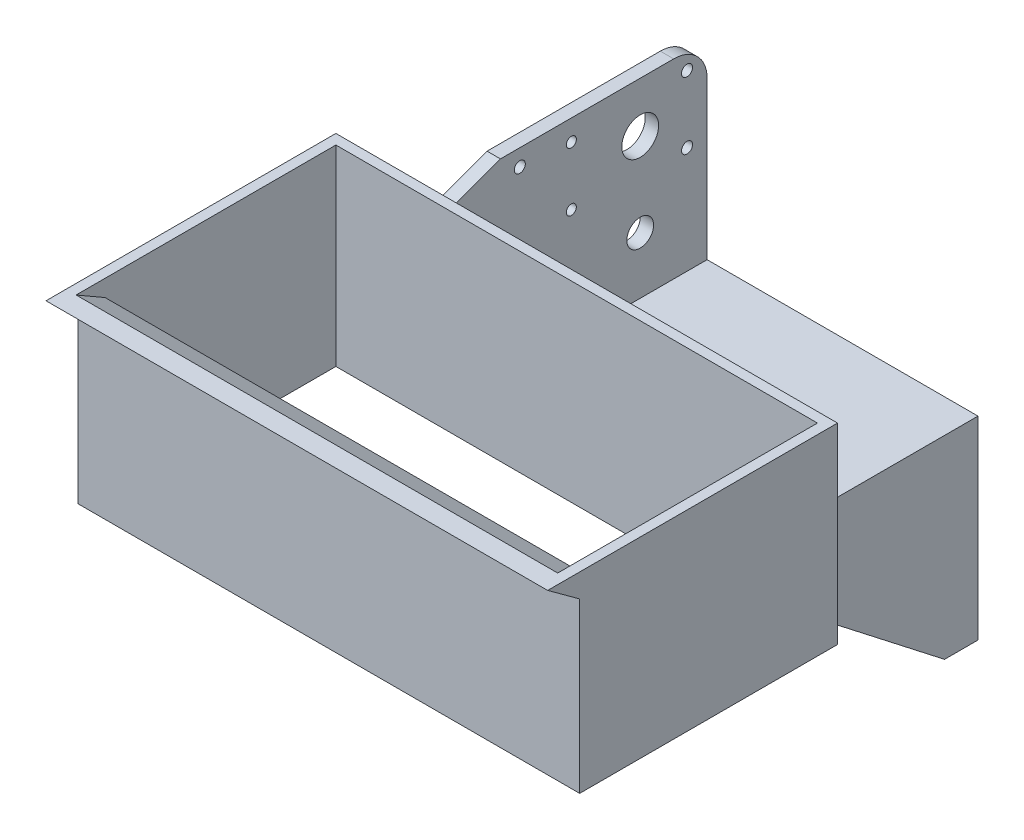
from build123d import *

# Parameters (mm, degrees)
SKETCH_1_W                   = 80
SKETCH_1_H                   = 50
EXTRUDE_1_DEPTH              = 5
HOLE_WIZARD_M5_1_D           = 4.2
HOLE_WIZARD_M5_1_DEPTH       = 11.1381927
HOLE_WIZARD_M5_1_TIP         = 1.2618073
EXTRUDE_START                = -12
SKETCH_5_W                   = 80
SKETCH_5_H                   = 50
EXTRUDE_2_DEPTH              = 2
HOLE_WIZARD_M4_1_AT_2_COUNT  = 2
HOLE_WIZARD_M4_1_AT_2_PITCH  = 20
HOLE_WIZARD_M4_1_AT_3_COUNT  = 2
HOLE_WIZARD_M4_1_AT_3_PITCH  = 50
HOLE_WIZARD_M4_1_AT_4_COUNT  = 2
HOLE_WIZARD_M4_1_AT_4_PITCH  = 53.851648071
SKETCH_11_R                  = 5.5
SKETCH_11_R_2                = 1.5
CUT_EXTRUDE_1_DEPTH          = 107.681769764
CUT_EXTRUDE_2_DEPTH          = 103.46950766
CUT_EXTRUDE_2_DEPTH_BACK     = 103.46950766
SKETCH_13_3_W                = 52
SKETCH_13_3_H                = 75
SKETCH_13_3_W_2              = 2
EXTRUDE_4_DEPTH              = 75
SKETCH_16_W                  = 80
SKETCH_16_H                  = 54
SKETCH_16_R                  = 2.1
EXTRUDE_5_DEPTH              = 10
SKETCH_17_W                  = 52
SKETCH_17_H                  = 51
CUT_EXTRUDE_4_DEPTH          = 65
SKETCH_18_W                  = 26
SKETCH_18_H                  = 5
SKETCH_18_W_2                = 2
EXTRUDE_6_DEPTH              = 75
SKETCH_19_R                  = 5.5
SKETCH_19_R_2                = 1.5
CUT_EXTRUDE_5_DEPTH          = 163.480768093
CUT_EXTRUDE_6_DEPTH          = 135.629120178
CUT_EXTRUDE_6_DEPTH_BACK     = 135.629120178
EXTRUDE_7_DEPTH              = 75
CUT_EXTRUDE_7_DEPTH          = 137.565002837
CUT_EXTRUDE_7_DEPTH_BACK     = 137.565002837
SKETCH_24_W                  = 102.975778391
SKETCH_24_H                  = 48.456033791
EXTRUDE_8_DEPTH              = 75
CUT_EXTRUDE_8_DEPTH          = 137.565002837
CUT_EXTRUDE_8_DEPTH_BACK     = 137.565002837
EXTRUDE_9_DEPTH              = 75
MIRROR_20_COPY_1_SKETCH_R    = 5.5
MIRROR_20_COPY_1_SKETCH_R_2  = 1.5
MIRROR_20_COPY_1_DEPTH       = 163.480768093
MIRROR_20_COPY_2_SKETCH_R    = 5.5
MIRROR_20_COPY_2_SKETCH_R_2  = 1.5
MIRROR_20_COPY_2_DEPTH       = 163.480768093
MIRROR_22_COPY_1_SKETCH_R    = 5.5
MIRROR_22_COPY_1_SKETCH_R_2  = 1.5
MIRROR_22_COPY_1_DEPTH       = 163.480768093
MIRROR_22_COPY_2_SKETCH_R    = 5.5
MIRROR_22_COPY_2_SKETCH_R_2  = 1.5
MIRROR_22_COPY_2_DEPTH       = 163.480768093
MIRROR_22_COPY_15_SKETCH_R   = 5.5
MIRROR_22_COPY_15_SKETCH_R_2 = 1.5
MIRROR_22_COPY_15_DEPTH      = 163.480768093
SKETCH_28_W                  = 112
SKETCH_28_H                  = 59.65855823
CUT_EXTRUDE_9_DEPTH          = 100
SKETCH_29_W                  = 150
SKETCH_29_H                  = 62.156680644
EXTRUDE_10_DEPTH             = 95
CUT_EXTRUDE_10_DEPTH         = 252.246890528
CUT_EXTRUDE_10_DEPTH_BACK    = 252.246890528
CUT_EXTRUDE_START            = -3
CUT_EXTRUDE_11_DEPTH         = 144
CUT_EXTRUDE_12_DEPTH         = 227.349287607
CUT_EXTRUDE_12_DEPTH_BACK    = 227.349287607
SKETCH_34_W                  = 45
SKETCH_34_H                  = 3
EXTRUDE_11_DEPTH             = 20
EXTRUDE_START_2              = -118
SKETCH_34_3_W                = 45
SKETCH_34_3_H                = 3
EXTRUDE_12_DEPTH             = 20
SKETCH_35_R                  = 2.1
SKETCH_35_W                  = 12
SKETCH_35_H                  = 54
CUT_EXTRUDE_13_DEPTH         = 10
SKETCH_37_W                  = 75
SKETCH_37_H                  = 62
SKETCH_37_R                  = 5.5
SKETCH_37_R_2                = 1.5
SKETCH_37_R_3                = 1.65
EXTRUDE_13_DEPTH             = 3
SKETCH_38_W                  = 45
SKETCH_38_H                  = 3
EXTRUDE_14_DEPTH             = 20
CUT_EXTRUDE_17_REACH         = 160.953
CUT_EXTRUDE_18_DEPTH         = 232.071417531
CUT_EXTRUDE_18_DEPTH_BACK    = 232.071417531
SKETCH_40_R                  = 4
SKETCH_48_W                  = 7.492398002
SKETCH_48_H                  = 29.711233458
SKETCH_48_W_2                = 8.655011485
EXTRUDE_18_DEPTH             = 10
CUT_EXTRUDE_20_DEPTH         = 212.00947846
CUT_EXTRUDE_20_DEPTH_BACK    = 212.00947846
CUT_EXTRUDE_22_DEPTH         = 2
EXTRUDE_20_DEPTH             = 14
CUT_EXTRUDE_23_DEPTH         = 207.458228221
CUT_EXTRUDE_23_DEPTH_BACK    = 207.458228221
SKETCH_52_R                  = 2.1
CUT_EXTRUDE_24_DEPTH         = 200.032660636
CUT_EXTRUDE_24_DEPTH_BACK    = 200.032660636
SKETCH_55_W                  = 12
SKETCH_55_H                  = 25
EXTRUDE_21_DEPTH             = 3
EXTRUDE_START_3              = 51
EXTRUDE_22_DEPTH             = 3
EXTRUDE_23_DEPTH             = 147
CUT_EXTRUDE_START_2          = -41
SKETCH_60_W                  = 48
SKETCH_60_H                  = 5
CUT_EXTRUDE_26_DEPTH         = 41
SKETCH_61_W                  = 144
SKETCH_61_H                  = 10.34377693
CUT_EXTRUDE_27_DEPTH         = 167
EXTRUDE_24_DEPTH             = 150
CUT_EXTRUDE_28_DEPTH         = 167
CUT_EXTRUDE_28_DEPTH_BACK    = 167
SKETCH_64_W                  = 144
SKETCH_64_H                  = 10
SKETCH_65_W                  = 150
SKETCH_65_H                  = 50.350916291
EXTRUDE_25_DEPTH             = 2.55
CUT_EXTRUDE_29_DEPTH         = 215.55
EXTRUDE_26_DEPTH             = 150
CUT_EXTRUDE_30_DEPTH         = 215.55
CUT_EXTRUDE_31_DEPTH         = 215.55
CUT_EXTRUDE_32_DEPTH         = 214.421451294
CUT_EXTRUDE_32_DEPTH_BACK    = 214.421451294
SKETCH_70_W                  = 144
SKETCH_70_H                  = 4.973795983
FILLET_1_R                   = 10
SKETCH_72_W                  = 16.700006523
SKETCH_72_H                  = 3
CUT_EXTRUDE_33_DEPTH         = 54.5
SKETCH_71_R                  = 4
SKETCH_71_R_2                = 1.65
SKETCH_71_R_3                = 5.5
SKETCH_71_R_4                = 1.5
EXTRUDE_27_DEPTH             = 8
SKETCH_73_W                  = 5
SKETCH_73_H                  = 5
EXTRUDE_28_DEPTH             = 75
CUT_EXTRUDE_34_REACH         = 201.66
SKETCH_74_W                  = 4
SKETCH_74_H                  = 57


with BuildPart() as part:
    # 草图1 → 凸台-拉伸1 (new body)
    with BuildSketch(Plane.XY):
        Rectangle(SKETCH_1_W, SKETCH_1_H)
    extrude(amount=EXTRUDE_1_DEPTH)

    # M5 螺纹孔1
    with Locations(Plane.XY.offset(5)):
        with Locations((-30, 20), (-30, -20), (30, -20), (30, 20)):
            Hole(HOLE_WIZARD_M5_1_D / 2, depth=HOLE_WIZARD_M5_1_DEPTH)
            with Locations((0, 0, -(HOLE_WIZARD_M5_1_DEPTH + HOLE_WIZARD_M5_1_TIP / 2))):  # 118° drill point
                Cone(0, HOLE_WIZARD_M5_1_D / 2, HOLE_WIZARD_M5_1_TIP, mode=Mode.SUBTRACT)

    # 草图5 → 凸台-拉伸2 (add)
    with BuildSketch(Plane(origin=(40, 0, 0), x_dir=(0, 0, -1), z_dir=(1, 0, 0)).offset(EXTRUDE_START)):
        with Locations((-40, 0)):
            Rectangle(SKETCH_5_W, SKETCH_5_H)
    extrude_2 = extrude(amount=-EXTRUDE_2_DEPTH)

    # 草图8 → M4 螺纹孔1 (revolve, cut)
    with BuildSketch(Plane(origin=(26, 20, 11), x_dir=(0, 0, 1), z_dir=(0, 1, 0))):
        Polygon((0, 0), (0, 10.1), (1.65, 9.108579979), (1.65, 0), align=None)
    hole_wizard_m4_1 = revolve(axis=Axis((19.65, 20, 11), (1, 0, 0)), mode=Mode.SUBTRACT)

    # M4 螺纹孔1 at 2: M4 螺纹孔1 ×2
    with Locations(*[(0, -i * HOLE_WIZARD_M4_1_AT_2_PITCH, 0) for i in range(1, HOLE_WIZARD_M4_1_AT_2_COUNT)]):
        add(hole_wizard_m4_1, mode=Mode.SUBTRACT)

    # M4 螺纹孔1 at 3: M4 螺纹孔1 ×2
    with Locations(*[(0, 0, i * HOLE_WIZARD_M4_1_AT_3_PITCH) for i in range(1, HOLE_WIZARD_M4_1_AT_3_COUNT)]):
        add(hole_wizard_m4_1, mode=Mode.SUBTRACT)

    # M4 螺纹孔1 at 4: M4 螺纹孔1 ×2
    with Locations(*[Vector(0, -0.3713906763541037, 0.9284766908852594) * (i * HOLE_WIZARD_M4_1_AT_4_PITCH) for i in range(1, HOLE_WIZARD_M4_1_AT_4_COUNT)]):
        add(hole_wizard_m4_1, mode=Mode.SUBTRACT)

    # 草图11 → 切除-拉伸1 (cut, through all)
    with BuildSketch(Plane.ZY.offset(-26)):
        with Locations((25, 10)):
            Circle(SKETCH_11_R)
        with Locations((45.6, 18.75)):
            Circle(SKETCH_11_R_2)
        with Locations((45.6, 1.25)):
            Circle(SKETCH_11_R_2)
    cut_extrude_1 = extrude(amount=-CUT_EXTRUDE_1_DEPTH, mode=Mode.SUBTRACT)

    # 镜向1: 凸台-拉伸2 across plane
    add(extrude_2.mirror(Plane(origin=(0, 0, 0), x_dir=(0, 0, 1), z_dir=(1, 0, 0))))

    # 镜向2: M4 螺纹孔1, 切除-拉伸1 across plane
    add(hole_wizard_m4_1.mirror(Plane(origin=(0, 0, 0), x_dir=(0, 0, 1), z_dir=(1, 0, 0))), mode=Mode.SUBTRACT)
    add(cut_extrude_1.mirror(Plane(origin=(0, 0, 0), x_dir=(0, 0, 1), z_dir=(1, 0, 0))), mode=Mode.SUBTRACT)

    # 镜向2 copy 1 sketch → 镜向2 copy 1 (revolve, cut)
    with BuildSketch(Plane(origin=(-26, 0, 11), x_dir=(0, 0, 1), z_dir=(0, 1, 0))):
        Polygon((0, 0), (0, -10.1), (1.65, -9.108579979), (1.65, 0), align=None)
    revolve(axis=Axis((-19.65, 0, 11), (1, 0, 0)), mode=Mode.SUBTRACT)

    # 镜向2 copy 2 sketch → 镜向2 copy 2 (revolve, cut)
    with BuildSketch(Plane(origin=(-26, 20, 61), x_dir=(0, 0, 1), z_dir=(0, 1, 0))):
        Polygon((0, 0), (0, -10.1), (1.65, -9.108579979), (1.65, 0), align=None)
    revolve(axis=Axis((-19.65, 20, 61), (1, 0, 0)), mode=Mode.SUBTRACT)

    # 镜向2 copy 3 sketch → 镜向2 copy 3 (revolve, cut)
    with BuildSketch(Plane(origin=(-26, 0, 61), x_dir=(0, 0, 1), z_dir=(0, 1, 0))):
        Polygon((0, 0), (0, -10.1), (1.65, -9.108579979), (1.65, 0), align=None)
    revolve(axis=Axis((-19.65, 0, 61), (1, 0, 0)), mode=Mode.SUBTRACT)

    # 草图13 → 切除-拉伸2 (cut, two sides: drawn at the far end of the back side and taken through both)
    with BuildSketch(Plane.XZ.offset(25).offset(-CUT_EXTRUDE_2_DEPTH_BACK)):
        Polygon((-26, 5), (-28, 5), (-40, 5), (-40, 0), (40, 0), (40, 5), (28, 5), (26, 5), align=None)
        Polygon((41.874754077, 5), (40, 5), (40, 0), (-40, 0), (-40, -4.933719331), (41.874754077, -4.933719331), align=None)
    extrude(amount=CUT_EXTRUDE_2_DEPTH + CUT_EXTRUDE_2_DEPTH_BACK, mode=Mode.SUBTRACT)


with BuildPart() as cut_extrude_2_piece_1:
    # of the separate pieces the step leaves, piece 1, a body of its own (cut_extrude_2_pieces)
    add(part.part.solids().sort_by_distance((28, -25, 5))[0])



with BuildPart() as cut_extrude_2_piece_2:
    # of the separate pieces the step leaves, piece 2, a body of its own (cut_extrude_2_pieces)
    add(part.part.solids().sort_by_distance((-26, -25, 5))[0])


with BuildPart() as cut_extrude_2_piece_1_1:
    add(cut_extrude_2_piece_1.part)

    add(cut_extrude_2_piece_2.part)  # 凸台-拉伸4 merges 切除-拉伸2 piece 2
    # 草图13<3> → 凸台-拉伸4 (add)
    with BuildSketch(Plane.XZ.offset(25)):
        with Locations((0, 42.5)):
            Rectangle(SKETCH_13_3_W, SKETCH_13_3_H)
        with Locations((-27, 42.5)):
            Rectangle(SKETCH_13_3_W_2, SKETCH_13_3_H)
        with Locations((27, 42.5)):
            Rectangle(SKETCH_13_3_W_2, SKETCH_13_3_H)
    extrude(amount=EXTRUDE_4_DEPTH)

    # 草图16 → 凸台-拉伸5 (add)
    with BuildSketch(Plane(origin=(0, 0, 5), x_dir=(-1, 0, 0), z_dir=(0, 0, -1))):
        with Locations((0, -73)):
            Rectangle(SKETCH_16_W, SKETCH_16_H)
        with Locations((-12, -83)):
            Circle(SKETCH_16_R, mode=Mode.SUBTRACT)
        with Locations((12, -83)):
            Circle(SKETCH_16_R, mode=Mode.SUBTRACT)
        with Locations((-12, -63)):
            Circle(SKETCH_16_R, mode=Mode.SUBTRACT)
        with Locations((12, -63)):
            Circle(SKETCH_16_R, mode=Mode.SUBTRACT)
    extrude(amount=-EXTRUDE_5_DEPTH)

    # 草图17 → 切除-拉伸4 (cut)
    with BuildSketch(Plane.XY.offset(80)):
        with Locations((0, -74.5)):
            Rectangle(SKETCH_17_W, SKETCH_17_H)
    extrude(amount=-CUT_EXTRUDE_4_DEPTH, mode=Mode.SUBTRACT)

    # 草图18 → 凸台-拉伸6 (add)
    with BuildSketch(Plane.XY.offset(80)):
        Polygon((-28, -25), (-28, -20), (-48, -20), (-48, 25), (-50, 25), (-50, -25), align=None)
        with Locations((-13, -22.5)):
            Rectangle(SKETCH_18_W, SKETCH_18_H)
        with Locations((-27, -22.5)):
            Rectangle(SKETCH_18_W_2, SKETCH_18_H)
        with Locations((13, -22.5)):
            Rectangle(SKETCH_18_W, SKETCH_18_H)
        with Locations((27, -22.5)):
            Rectangle(SKETCH_18_W_2, SKETCH_18_H)
        Polygon((48, -20), (28, -20), (28, -25), (50, -25), (50, 25), (48, 25), align=None)
    extrude(amount=-EXTRUDE_6_DEPTH)

    # 草图19 → 切除-拉伸5 (cut, symmetric)
    with BuildSketch(Plane.ZY.offset(50)):
        with Locations((25, 10)):
            Circle(SKETCH_19_R)
        with Locations((45.6, 18.75)):
            Circle(SKETCH_19_R_2)
        with Locations((45.6, 1.25)):
            Circle(SKETCH_19_R_2)
    cut_extrude_5 = extrude(amount=CUT_EXTRUDE_5_DEPTH, both=True, mode=Mode.SUBTRACT)

    # 镜向3: M4 螺纹孔1 across plane
    add(hole_wizard_m4_1.mirror(Plane.ZY.offset(11)), mode=Mode.SUBTRACT)

    # 镜向3 copy 1 sketch → 镜向3 copy 1 (revolve, cut)
    with BuildSketch(Plane(origin=(-48, 0, 11), x_dir=(0, 0, 1), z_dir=(0, 1, 0))):
        Polygon((0, 0), (0, -10.1), (1.65, -9.108579979), (1.65, 0), align=None)
    revolve(axis=Axis((-41.65, 0, 11), (1, 0, 0)), mode=Mode.SUBTRACT)

    # 镜向3 copy 2 sketch → 镜向3 copy 2 (revolve, cut)
    with BuildSketch(Plane(origin=(-48, 20, 61), x_dir=(0, 0, 1), z_dir=(0, 1, 0))):
        Polygon((0, 0), (0, -10.1), (1.65, -9.108579979), (1.65, 0), align=None)
    revolve(axis=Axis((-41.65, 20, 61), (1, 0, 0)), mode=Mode.SUBTRACT)

    # 镜向3 copy 3 sketch → 镜向3 copy 3 (revolve, cut)
    with BuildSketch(Plane(origin=(-48, 0, 61), x_dir=(0, 0, 1), z_dir=(0, 1, 0))):
        Polygon((0, 0), (0, -10.1), (1.65, -9.108579979), (1.65, 0), align=None)
    revolve(axis=Axis((-41.65, 0, 61), (1, 0, 0)), mode=Mode.SUBTRACT)

    # 镜向4: M4 螺纹孔1 across plane
    add(hole_wizard_m4_1.mirror(Plane(origin=(38, 0, 0), x_dir=(0, 0, 1), z_dir=(1, 0, 0))), mode=Mode.SUBTRACT)

    # 镜向4 copy 1 sketch → 镜向4 copy 1 (revolve, cut)
    with BuildSketch(Plane(origin=(50, 0, 11), x_dir=(0, 0, 1), z_dir=(0, 1, 0))):
        Polygon((0, 0), (0, -10.1), (1.65, -9.108579979), (1.65, 0), align=None)
    revolve(axis=Axis((56.35, 0, 11), (1, 0, 0)), mode=Mode.SUBTRACT)

    # 镜向4 copy 2 sketch → 镜向4 copy 2 (revolve, cut)
    with BuildSketch(Plane(origin=(50, 20, 61), x_dir=(0, 0, 1), z_dir=(0, 1, 0))):
        Polygon((0, 0), (0, -10.1), (1.65, -9.108579979), (1.65, 0), align=None)
    revolve(axis=Axis((56.35, 20, 61), (1, 0, 0)), mode=Mode.SUBTRACT)

    # 镜向4 copy 3 sketch → 镜向4 copy 3 (revolve, cut)
    with BuildSketch(Plane(origin=(50, 0, 61), x_dir=(0, 0, 1), z_dir=(0, 1, 0))):
        Polygon((0, 0), (0, -10.1), (1.65, -9.108579979), (1.65, 0), align=None)
    revolve(axis=Axis((56.35, 0, 61), (1, 0, 0)), mode=Mode.SUBTRACT)

    # 草图21 → 切除-拉伸6 (cut, two sides: drawn at the far end of the back side and taken through both)
    with BuildSketch(Plane.XY.offset(80).offset(-CUT_EXTRUDE_6_DEPTH_BACK)):
        Polygon((-31.758611736, 26.765489653), (-31.758611736, -20), (32.437571978, -20), (32.437571978, 28.405937278), align=None)
    extrude(amount=CUT_EXTRUDE_6_DEPTH + CUT_EXTRUDE_6_DEPTH_BACK, mode=Mode.SUBTRACT)

    # 草图22 → 凸台-拉伸7 (add)
    with BuildSketch(Plane.XY.offset(80)):
        Polygon((-53, 25), (-55, 25), (-55, -25), (-50, -25), (-50, -20), (-53, -20), align=None)
        Polygon((55, 25), (53, 25), (53, -20), (50, -20), (50, -25), (55, -25), align=None)
        Polygon((-50, -20), (-50, -25), (-28, -25), (28, -25), (50, -25), (50, -20), (48, -20), (0, -20), (-48, -20), align=None)
    extrude(amount=-EXTRUDE_7_DEPTH)

    # 镜向8: 切除-拉伸5 across plane
    add(cut_extrude_5.mirror(Plane(origin=(-51.5, 0, 0), x_dir=(0, 0, 1), z_dir=(1, 0, 0))), mode=Mode.SUBTRACT)

    # 镜向16 copy 1 sketch → 镜向16 copy 1 (revolve, cut)
    with BuildSketch(Plane(origin=(53, 20, 11), x_dir=(0, 0, 1), z_dir=(0, 1, 0))):
        Polygon((0, 0), (0, 10.1), (1.65, 9.108579979), (1.65, 0), align=None)
    revolve(axis=Axis((46.65, 20, 11), (1, 0, 0)), mode=Mode.SUBTRACT)

    # 镜向16 copy 2 sketch → 镜向16 copy 2 (revolve, cut)
    with BuildSketch(Plane(origin=(53, 0, 11), x_dir=(0, 0, 1), z_dir=(0, 1, 0))):
        Polygon((0, 0), (0, 10.1), (1.65, 9.108579979), (1.65, 0), align=None)
    revolve(axis=Axis((46.65, 0, 11), (1, 0, 0)), mode=Mode.SUBTRACT)

    # 镜向16 copy 3 sketch → 镜向16 copy 3 (revolve, cut)
    with BuildSketch(Plane(origin=(53, 20, 61), x_dir=(0, 0, 1), z_dir=(0, 1, 0))):
        Polygon((0, 0), (0, 10.1), (1.65, 9.108579979), (1.65, 0), align=None)
    revolve(axis=Axis((46.65, 20, 61), (1, 0, 0)), mode=Mode.SUBTRACT)

    # 镜向16 copy 4 sketch → 镜向16 copy 4 (revolve, cut)
    with BuildSketch(Plane(origin=(53, 0, 61), x_dir=(0, 0, 1), z_dir=(0, 1, 0))):
        Polygon((0, 0), (0, 10.1), (1.65, 9.108579979), (1.65, 0), align=None)
    revolve(axis=Axis((46.65, 0, 61), (1, 0, 0)), mode=Mode.SUBTRACT)

    # 镜向16 copy 5 sketch → 镜向16 copy 5 (revolve, cut)
    with BuildSketch(Plane(origin=(-21, 20, 11), x_dir=(0, 0, 1), z_dir=(0, 1, 0))):
        Polygon((0, 0), (0, -10.1), (1.65, -9.108579979), (1.65, 0), align=None)
    revolve(axis=Axis((-14.65, 20, 11), (1, 0, 0)), mode=Mode.SUBTRACT)

    # 镜向16 copy 6 sketch → 镜向16 copy 6 (revolve, cut)
    with BuildSketch(Plane(origin=(-21, 0, 11), x_dir=(0, 0, 1), z_dir=(0, 1, 0))):
        Polygon((0, 0), (0, -10.1), (1.65, -9.108579979), (1.65, 0), align=None)
    revolve(axis=Axis((-14.65, 0, 11), (1, 0, 0)), mode=Mode.SUBTRACT)

    # 镜向16 copy 7 sketch → 镜向16 copy 7 (revolve, cut)
    with BuildSketch(Plane(origin=(-21, 20, 61), x_dir=(0, 0, 1), z_dir=(0, 1, 0))):
        Polygon((0, 0), (0, -10.1), (1.65, -9.108579979), (1.65, 0), align=None)
    revolve(axis=Axis((-14.65, 20, 61), (1, 0, 0)), mode=Mode.SUBTRACT)

    # 镜向16 copy 8 sketch → 镜向16 copy 8 (revolve, cut)
    with BuildSketch(Plane(origin=(-21, 0, 61), x_dir=(0, 0, 1), z_dir=(0, 1, 0))):
        Polygon((0, 0), (0, -10.1), (1.65, -9.108579979), (1.65, 0), align=None)
    revolve(axis=Axis((-14.65, 0, 61), (1, 0, 0)), mode=Mode.SUBTRACT)

    # 镜向18 copy 1 sketch → 镜向18 copy 1 (revolve, cut)
    with BuildSketch(Plane(origin=(-53, 20, 11), x_dir=(0, 0, 1), z_dir=(0, 1, 0))):
        Polygon((0, 0), (0, -10.1), (1.65, -9.108579979), (1.65, 0), align=None)
    revolve(axis=Axis((-46.65, 20, 11), (1, 0, 0)), mode=Mode.SUBTRACT)

    # 镜向18 copy 2 sketch → 镜向18 copy 2 (revolve, cut)
    with BuildSketch(Plane(origin=(-53, 0, 11), x_dir=(0, 0, 1), z_dir=(0, 1, 0))):
        Polygon((0, 0), (0, -10.1), (1.65, -9.108579979), (1.65, 0), align=None)
    revolve(axis=Axis((-46.65, 0, 11), (1, 0, 0)), mode=Mode.SUBTRACT)

    # 镜向18 copy 3 sketch → 镜向18 copy 3 (revolve, cut)
    with BuildSketch(Plane(origin=(-53, 20, 61), x_dir=(0, 0, 1), z_dir=(0, 1, 0))):
        Polygon((0, 0), (0, -10.1), (1.65, -9.108579979), (1.65, 0), align=None)
    revolve(axis=Axis((-46.65, 20, 61), (1, 0, 0)), mode=Mode.SUBTRACT)

    # 镜向18 copy 4 sketch → 镜向18 copy 4 (revolve, cut)
    with BuildSketch(Plane(origin=(-53, 0, 61), x_dir=(0, 0, 1), z_dir=(0, 1, 0))):
        Polygon((0, 0), (0, -10.1), (1.65, -9.108579979), (1.65, 0), align=None)
    revolve(axis=Axis((-46.65, 0, 61), (1, 0, 0)), mode=Mode.SUBTRACT)

    # 镜向18 copy 5 sketch → 镜向18 copy 5 (revolve, cut)
    with BuildSketch(Plane(origin=(21, 20, 11), x_dir=(0, 0, 1), z_dir=(0, 1, 0))):
        Polygon((0, 0), (0, 10.1), (1.65, 9.108579979), (1.65, 0), align=None)
    revolve(axis=Axis((14.65, 20, 11), (1, 0, 0)), mode=Mode.SUBTRACT)

    # 镜向18 copy 6 sketch → 镜向18 copy 6 (revolve, cut)
    with BuildSketch(Plane(origin=(21, 0, 11), x_dir=(0, 0, 1), z_dir=(0, 1, 0))):
        Polygon((0, 0), (0, 10.1), (1.65, 9.108579979), (1.65, 0), align=None)
    revolve(axis=Axis((14.65, 0, 11), (1, 0, 0)), mode=Mode.SUBTRACT)

    # 镜向18 copy 7 sketch → 镜向18 copy 7 (revolve, cut)
    with BuildSketch(Plane(origin=(21, 20, 61), x_dir=(0, 0, 1), z_dir=(0, 1, 0))):
        Polygon((0, 0), (0, 10.1), (1.65, 9.108579979), (1.65, 0), align=None)
    revolve(axis=Axis((14.65, 20, 61), (1, 0, 0)), mode=Mode.SUBTRACT)

    # 镜向18 copy 8 sketch → 镜向18 copy 8 (revolve, cut)
    with BuildSketch(Plane(origin=(21, 0, 61), x_dir=(0, 0, 1), z_dir=(0, 1, 0))):
        Polygon((0, 0), (0, 10.1), (1.65, 9.108579979), (1.65, 0), align=None)
    revolve(axis=Axis((14.65, 0, 61), (1, 0, 0)), mode=Mode.SUBTRACT)

    # 镜向18 copy 9 sketch → 镜向18 copy 9 (revolve, cut)
    with BuildSketch(Plane(origin=(-26, 20, 11), x_dir=(0, 0, 1), z_dir=(0, 1, 0))):
        Polygon((0, 0), (0, -10.1), (1.65, -9.108579979), (1.65, 0), align=None)
    revolve(axis=Axis((-19.65, 20, 11), (1, 0, 0)), mode=Mode.SUBTRACT)

    # 镜向18 copy 10 sketch → 镜向18 copy 10 (revolve, cut)
    with BuildSketch(Plane(origin=(-26, 0, 11), x_dir=(0, 0, 1), z_dir=(0, 1, 0))):
        Polygon((0, 0), (0, -10.1), (1.65, -9.108579979), (1.65, 0), align=None)
    revolve(axis=Axis((-19.65, 0, 11), (1, 0, 0)), mode=Mode.SUBTRACT)

    # 镜向18 copy 11 sketch → 镜向18 copy 11 (revolve, cut)
    with BuildSketch(Plane(origin=(-26, 20, 61), x_dir=(0, 0, 1), z_dir=(0, 1, 0))):
        Polygon((0, 0), (0, -10.1), (1.65, -9.108579979), (1.65, 0), align=None)
    revolve(axis=Axis((-19.65, 20, 61), (1, 0, 0)), mode=Mode.SUBTRACT)

    # 镜向18 copy 12 sketch → 镜向18 copy 12 (revolve, cut)
    with BuildSketch(Plane(origin=(-26, 0, 61), x_dir=(0, 0, 1), z_dir=(0, 1, 0))):
        Polygon((0, 0), (0, -10.1), (1.65, -9.108579979), (1.65, 0), align=None)
    revolve(axis=Axis((-19.65, 0, 61), (1, 0, 0)), mode=Mode.SUBTRACT)

    # 草图24 → 切除-拉伸7 (cut, two sides: drawn at the far end of the back side and taken through both)
    with BuildSketch(Plane(origin=(0, 0, 5), x_dir=(-1, 0, 0), z_dir=(0, 0, -1)).offset(-CUT_EXTRUDE_7_DEPTH_BACK)):
        with Locations((0.012110804, 4.228016896)):
            Rectangle(SKETCH_24_W, SKETCH_24_H)
    extrude(amount=CUT_EXTRUDE_7_DEPTH + CUT_EXTRUDE_7_DEPTH_BACK, mode=Mode.SUBTRACT)

    # 草图25 → 凸台-拉伸8 (add)
    with BuildSketch(Plane(origin=(0, 0, 5), x_dir=(-1, 0, 0), z_dir=(0, 0, -1))):
        Polygon((-53, -25), (-53, -32), (53, -32), (53, -25), (55, -25), (55, -37), (-55, -37), (-55, -25), align=None)
    extrude(amount=-EXTRUDE_8_DEPTH)

    # 草图26 → 切除-拉伸8 (cut, two sides: drawn at the far end of the back side and taken through both)
    with BuildSketch(Plane(origin=(0, 0, 5), x_dir=(-1, 0, 0), z_dir=(0, 0, -1)).offset(-CUT_EXTRUDE_8_DEPTH_BACK)):
        Polygon((-53, -20), (-53, -32), (53, -32), (53, -15.706954255), (-53, -15.706954255), align=None)
    extrude(amount=CUT_EXTRUDE_8_DEPTH + CUT_EXTRUDE_8_DEPTH_BACK, mode=Mode.SUBTRACT)

    # 草图27 → 凸台-拉伸9 (add)
    with BuildSketch(Plane(origin=(0, 0, 5), x_dir=(-1, 0, 0), z_dir=(0, 0, -1))):
        Polygon((-59, 25), (-59, -37), (59, -37), (59, 25), (57, 25), (57, -32), (-57, -32), (-57, 25), align=None)
    extrude(amount=-EXTRUDE_9_DEPTH)

    # 镜向20 copy 1 sketch → 镜向20 copy 1 (cut, symmetric)
    with BuildSketch(Plane.ZY.offset(-165)):
        with Locations((25, 10)):
            Circle(MIRROR_20_COPY_1_SKETCH_R)
        with Locations((45.6, 18.75)):
            Circle(MIRROR_20_COPY_1_SKETCH_R_2)
        with Locations((45.6, 1.25)):
            Circle(MIRROR_20_COPY_1_SKETCH_R_2)
    extrude(amount=MIRROR_20_COPY_1_DEPTH, both=True, mode=Mode.SUBTRACT)

    # 镜向20 copy 2 sketch → 镜向20 copy 2 (cut, symmetric)
    with BuildSketch(Plane(origin=(162, 0, 0), x_dir=(0, 0, 1), z_dir=(1, 0, 0))):
        with Locations((25, -10)):
            Circle(MIRROR_20_COPY_2_SKETCH_R)
        with Locations((45.6, -18.75)):
            Circle(MIRROR_20_COPY_2_SKETCH_R_2)
        with Locations((45.6, -1.25)):
            Circle(MIRROR_20_COPY_2_SKETCH_R_2)
    extrude(amount=MIRROR_20_COPY_2_DEPTH, both=True, mode=Mode.SUBTRACT)

    # 镜向20 copy 3 sketch → 镜向20 copy 3 (revolve, cut)
    with BuildSketch(Plane(origin=(59, 20, 11), x_dir=(0, 0, 1), z_dir=(0, 1, 0))):
        Polygon((0, 0), (0, -10.1), (1.65, -9.108579979), (1.65, 0), align=None)
    revolve(axis=Axis((65.35, 20, 11), (1, 0, 0)), mode=Mode.SUBTRACT)

    # 镜向20 copy 4 sketch → 镜向20 copy 4 (revolve, cut)
    with BuildSketch(Plane(origin=(59, 0, 11), x_dir=(0, 0, 1), z_dir=(0, 1, 0))):
        Polygon((0, 0), (0, -10.1), (1.65, -9.108579979), (1.65, 0), align=None)
    revolve(axis=Axis((65.35, 0, 11), (1, 0, 0)), mode=Mode.SUBTRACT)

    # 镜向20 copy 5 sketch → 镜向20 copy 5 (revolve, cut)
    with BuildSketch(Plane(origin=(59, 20, 61), x_dir=(0, 0, 1), z_dir=(0, 1, 0))):
        Polygon((0, 0), (0, -10.1), (1.65, -9.108579979), (1.65, 0), align=None)
    revolve(axis=Axis((65.35, 20, 61), (1, 0, 0)), mode=Mode.SUBTRACT)

    # 镜向20 copy 6 sketch → 镜向20 copy 6 (revolve, cut)
    with BuildSketch(Plane(origin=(59, 0, 61), x_dir=(0, 0, 1), z_dir=(0, 1, 0))):
        Polygon((0, 0), (0, -10.1), (1.65, -9.108579979), (1.65, 0), align=None)
    revolve(axis=Axis((65.35, 0, 61), (1, 0, 0)), mode=Mode.SUBTRACT)

    # 镜向20 copy 7 sketch → 镜向20 copy 7 (revolve, cut)
    with BuildSketch(Plane(origin=(133, 20, 11), x_dir=(0, 0, 1), z_dir=(0, 1, 0))):
        Polygon((0, 0), (0, 10.1), (1.65, 9.108579979), (1.65, 0), align=None)
    revolve(axis=Axis((126.65, 20, 11), (1, 0, 0)), mode=Mode.SUBTRACT)

    # 镜向20 copy 8 sketch → 镜向20 copy 8 (revolve, cut)
    with BuildSketch(Plane(origin=(133, 0, 11), x_dir=(0, 0, 1), z_dir=(0, 1, 0))):
        Polygon((0, 0), (0, 10.1), (1.65, 9.108579979), (1.65, 0), align=None)
    revolve(axis=Axis((126.65, 0, 11), (1, 0, 0)), mode=Mode.SUBTRACT)

    # 镜向20 copy 9 sketch → 镜向20 copy 9 (revolve, cut)
    with BuildSketch(Plane(origin=(133, 20, 61), x_dir=(0, 0, 1), z_dir=(0, 1, 0))):
        Polygon((0, 0), (0, 10.1), (1.65, 9.108579979), (1.65, 0), align=None)
    revolve(axis=Axis((126.65, 20, 61), (1, 0, 0)), mode=Mode.SUBTRACT)

    # 镜向20 copy 10 sketch → 镜向20 copy 10 (revolve, cut)
    with BuildSketch(Plane(origin=(133, 0, 61), x_dir=(0, 0, 1), z_dir=(0, 1, 0))):
        Polygon((0, 0), (0, 10.1), (1.65, 9.108579979), (1.65, 0), align=None)
    revolve(axis=Axis((126.65, 0, 61), (1, 0, 0)), mode=Mode.SUBTRACT)

    # 镜向20 copy 11 sketch → 镜向20 copy 11 (revolve, cut)
    with BuildSketch(Plane(origin=(86, 20, 11), x_dir=(0, 0, 1), z_dir=(0, 1, 0))):
        Polygon((0, 0), (0, -10.1), (1.65, -9.108579979), (1.65, 0), align=None)
    revolve(axis=Axis((92.35, 20, 11), (1, 0, 0)), mode=Mode.SUBTRACT)

    # 镜向20 copy 12 sketch → 镜向20 copy 12 (revolve, cut)
    with BuildSketch(Plane(origin=(86, 0, 11), x_dir=(0, 0, 1), z_dir=(0, 1, 0))):
        Polygon((0, 0), (0, -10.1), (1.65, -9.108579979), (1.65, 0), align=None)
    revolve(axis=Axis((92.35, 0, 11), (1, 0, 0)), mode=Mode.SUBTRACT)

    # 镜向20 copy 13 sketch → 镜向20 copy 13 (revolve, cut)
    with BuildSketch(Plane(origin=(86, 20, 61), x_dir=(0, 0, 1), z_dir=(0, 1, 0))):
        Polygon((0, 0), (0, -10.1), (1.65, -9.108579979), (1.65, 0), align=None)
    revolve(axis=Axis((92.35, 20, 61), (1, 0, 0)), mode=Mode.SUBTRACT)

    # 镜向20 copy 14 sketch → 镜向20 copy 14 (revolve, cut)
    with BuildSketch(Plane(origin=(86, 0, 61), x_dir=(0, 0, 1), z_dir=(0, 1, 0))):
        Polygon((0, 0), (0, -10.1), (1.65, -9.108579979), (1.65, 0), align=None)
    revolve(axis=Axis((92.35, 0, 61), (1, 0, 0)), mode=Mode.SUBTRACT)

    # 镜向22 copy 1 sketch → 镜向22 copy 1 (cut, symmetric)
    with BuildSketch(Plane(origin=(-165, 0, 0), x_dir=(0, 0, 1), z_dir=(1, 0, 0))):
        with Locations((25, -10)):
            Circle(MIRROR_22_COPY_1_SKETCH_R)
        with Locations((45.6, -18.75)):
            Circle(MIRROR_22_COPY_1_SKETCH_R_2)
        with Locations((45.6, -1.25)):
            Circle(MIRROR_22_COPY_1_SKETCH_R_2)
    extrude(amount=MIRROR_22_COPY_1_DEPTH, both=True, mode=Mode.SUBTRACT)

    # 镜向22 copy 2 sketch → 镜向22 copy 2 (cut, symmetric)
    with BuildSketch(Plane.ZY.offset(162)):
        with Locations((25, 10)):
            Circle(MIRROR_22_COPY_2_SKETCH_R)
        with Locations((45.6, 18.75)):
            Circle(MIRROR_22_COPY_2_SKETCH_R_2)
        with Locations((45.6, 1.25)):
            Circle(MIRROR_22_COPY_2_SKETCH_R_2)
    extrude(amount=MIRROR_22_COPY_2_DEPTH, both=True, mode=Mode.SUBTRACT)

    # 镜向22 copy 3 sketch → 镜向22 copy 3 (revolve, cut)
    with BuildSketch(Plane(origin=(-59, 20, 11), x_dir=(0, 0, 1), z_dir=(0, 1, 0))):
        Polygon((0, 0), (0, 10.1), (1.65, 9.108579979), (1.65, 0), align=None)
    revolve(axis=Axis((-65.35, 20, 11), (1, 0, 0)), mode=Mode.SUBTRACT)

    # 镜向22 copy 4 sketch → 镜向22 copy 4 (revolve, cut)
    with BuildSketch(Plane(origin=(-59, 0, 11), x_dir=(0, 0, 1), z_dir=(0, 1, 0))):
        Polygon((0, 0), (0, 10.1), (1.65, 9.108579979), (1.65, 0), align=None)
    revolve(axis=Axis((-65.35, 0, 11), (1, 0, 0)), mode=Mode.SUBTRACT)

    # 镜向22 copy 5 sketch → 镜向22 copy 5 (revolve, cut)
    with BuildSketch(Plane(origin=(-59, 20, 61), x_dir=(0, 0, 1), z_dir=(0, 1, 0))):
        Polygon((0, 0), (0, 10.1), (1.65, 9.108579979), (1.65, 0), align=None)
    revolve(axis=Axis((-65.35, 20, 61), (1, 0, 0)), mode=Mode.SUBTRACT)

    # 镜向22 copy 6 sketch → 镜向22 copy 6 (revolve, cut)
    with BuildSketch(Plane(origin=(-59, 0, 61), x_dir=(0, 0, 1), z_dir=(0, 1, 0))):
        Polygon((0, 0), (0, 10.1), (1.65, 9.108579979), (1.65, 0), align=None)
    revolve(axis=Axis((-65.35, 0, 61), (1, 0, 0)), mode=Mode.SUBTRACT)

    # 镜向22 copy 7 sketch → 镜向22 copy 7 (revolve, cut)
    with BuildSketch(Plane(origin=(-133, 20, 11), x_dir=(0, 0, 1), z_dir=(0, 1, 0))):
        Polygon((0, 0), (0, -10.1), (1.65, -9.108579979), (1.65, 0), align=None)
    revolve(axis=Axis((-126.65, 20, 11), (1, 0, 0)), mode=Mode.SUBTRACT)

    # 镜向22 copy 8 sketch → 镜向22 copy 8 (revolve, cut)
    with BuildSketch(Plane(origin=(-133, 0, 11), x_dir=(0, 0, 1), z_dir=(0, 1, 0))):
        Polygon((0, 0), (0, -10.1), (1.65, -9.108579979), (1.65, 0), align=None)
    revolve(axis=Axis((-126.65, 0, 11), (1, 0, 0)), mode=Mode.SUBTRACT)

    # 镜向22 copy 9 sketch → 镜向22 copy 9 (revolve, cut)
    with BuildSketch(Plane(origin=(-133, 20, 61), x_dir=(0, 0, 1), z_dir=(0, 1, 0))):
        Polygon((0, 0), (0, -10.1), (1.65, -9.108579979), (1.65, 0), align=None)
    revolve(axis=Axis((-126.65, 20, 61), (1, 0, 0)), mode=Mode.SUBTRACT)

    # 镜向22 copy 10 sketch → 镜向22 copy 10 (revolve, cut)
    with BuildSketch(Plane(origin=(-133, 0, 61), x_dir=(0, 0, 1), z_dir=(0, 1, 0))):
        Polygon((0, 0), (0, -10.1), (1.65, -9.108579979), (1.65, 0), align=None)
    revolve(axis=Axis((-126.65, 0, 61), (1, 0, 0)), mode=Mode.SUBTRACT)

    # 镜向22 copy 11 sketch → 镜向22 copy 11 (revolve, cut)
    with BuildSketch(Plane(origin=(-86, 20, 11), x_dir=(0, 0, 1), z_dir=(0, 1, 0))):
        Polygon((0, 0), (0, 10.1), (1.65, 9.108579979), (1.65, 0), align=None)
    revolve(axis=Axis((-92.35, 20, 11), (1, 0, 0)), mode=Mode.SUBTRACT)

    # 镜向22 copy 12 sketch → 镜向22 copy 12 (revolve, cut)
    with BuildSketch(Plane(origin=(-86, 0, 11), x_dir=(0, 0, 1), z_dir=(0, 1, 0))):
        Polygon((0, 0), (0, 10.1), (1.65, 9.108579979), (1.65, 0), align=None)
    revolve(axis=Axis((-92.35, 0, 11), (1, 0, 0)), mode=Mode.SUBTRACT)

    # 镜向22 copy 13 sketch → 镜向22 copy 13 (revolve, cut)
    with BuildSketch(Plane(origin=(-86, 20, 61), x_dir=(0, 0, 1), z_dir=(0, 1, 0))):
        Polygon((0, 0), (0, 10.1), (1.65, 9.108579979), (1.65, 0), align=None)
    revolve(axis=Axis((-92.35, 20, 61), (1, 0, 0)), mode=Mode.SUBTRACT)

    # 镜向22 copy 14 sketch → 镜向22 copy 14 (revolve, cut)
    with BuildSketch(Plane(origin=(-86, 0, 61), x_dir=(0, 0, 1), z_dir=(0, 1, 0))):
        Polygon((0, 0), (0, 10.1), (1.65, 9.108579979), (1.65, 0), align=None)
    revolve(axis=Axis((-92.35, 0, 61), (1, 0, 0)), mode=Mode.SUBTRACT)

    # 镜向22 copy 15 sketch → 镜向22 copy 15 (cut, symmetric)
    with BuildSketch(Plane(origin=(50, 0, 0), x_dir=(0, 0, 1), z_dir=(1, 0, 0))):
        with Locations((25, -10)):
            Circle(MIRROR_22_COPY_15_SKETCH_R)
        with Locations((45.6, -18.75)):
            Circle(MIRROR_22_COPY_15_SKETCH_R_2)
        with Locations((45.6, -1.25)):
            Circle(MIRROR_22_COPY_15_SKETCH_R_2)
    extrude(amount=MIRROR_22_COPY_15_DEPTH, both=True, mode=Mode.SUBTRACT)

    # 镜向22 copy 16 sketch → 镜向22 copy 16 (revolve, cut)
    with BuildSketch(Plane(origin=(-26, 20, 11), x_dir=(0, 0, 1), z_dir=(0, 1, 0))):
        Polygon((0, 0), (0, -10.1), (1.65, -9.108579979), (1.65, 0), align=None)
    revolve(axis=Axis((-19.65, 20, 11), (1, 0, 0)), mode=Mode.SUBTRACT)

    # 镜向22 copy 17 sketch → 镜向22 copy 17 (revolve, cut)
    with BuildSketch(Plane(origin=(-26, 0, 11), x_dir=(0, 0, 1), z_dir=(0, 1, 0))):
        Polygon((0, 0), (0, -10.1), (1.65, -9.108579979), (1.65, 0), align=None)
    revolve(axis=Axis((-19.65, 0, 11), (1, 0, 0)), mode=Mode.SUBTRACT)

    # 镜向22 copy 18 sketch → 镜向22 copy 18 (revolve, cut)
    with BuildSketch(Plane(origin=(-26, 20, 61), x_dir=(0, 0, 1), z_dir=(0, 1, 0))):
        Polygon((0, 0), (0, -10.1), (1.65, -9.108579979), (1.65, 0), align=None)
    revolve(axis=Axis((-19.65, 20, 61), (1, 0, 0)), mode=Mode.SUBTRACT)

    # 镜向22 copy 19 sketch → 镜向22 copy 19 (revolve, cut)
    with BuildSketch(Plane(origin=(-26, 0, 61), x_dir=(0, 0, 1), z_dir=(0, 1, 0))):
        Polygon((0, 0), (0, -10.1), (1.65, -9.108579979), (1.65, 0), align=None)
    revolve(axis=Axis((-19.65, 0, 61), (1, 0, 0)), mode=Mode.SUBTRACT)

    # 草图28 → 切除-拉伸9 (cut)
    with BuildSketch(Plane(origin=(0, 0, 5), x_dir=(-1, 0, 0), z_dir=(0, 0, -1))):
        with Locations((0, -2.170720885)):
            Rectangle(SKETCH_28_W, SKETCH_28_H)
    extrude(amount=-CUT_EXTRUDE_9_DEPTH, mode=Mode.SUBTRACT)

    # 草图29 → 凸台-拉伸10 (add)
    with BuildSketch(Plane.XY.offset(80)):
        with Locations((0, -6.078340322)):
            Rectangle(SKETCH_29_W, SKETCH_29_H)
    extrude(amount=EXTRUDE_10_DEPTH)

    # 草图30 → 切除-拉伸10 (cut, two sides: drawn at the far end of the back side and taken through both)
    with BuildSketch(Plane.ZY.offset(75).offset(-CUT_EXTRUDE_10_DEPTH_BACK)):
        Polygon((549.139391609, 241.00947846), (175, 25), (145, 7.679491924), (145, -37.156680644), (145, -469.175637564), (895.959346342, -896.518095898), (1300.098737952, -186.332979874), align=None)
    extrude(amount=CUT_EXTRUDE_10_DEPTH + CUT_EXTRUDE_10_DEPTH_BACK, mode=Mode.SUBTRACT)

    # 草图31 → 切除-拉伸11 (cut)
    with BuildSketch(Plane.ZY.offset(75).offset(CUT_EXTRUDE_START)):
        Polygon((83, 29.827532825), (177.361532128, 29.827532825), (142, 9.411542732), (142, -50.308719278), (83, -50.308719278), align=None)
    extrude(amount=-CUT_EXTRUDE_11_DEPTH, mode=Mode.SUBTRACT)

    # 草图32 → 切除-拉伸12 (cut, two sides: drawn at the far end of the back side and taken through both)
    with BuildSketch(Plane(origin=(28, 0, 0), x_dir=(0, 0, -1), z_dir=(1, 0, 0)).offset(-CUT_EXTRUDE_12_DEPTH_BACK)):
        Polygon((-80, -37.156680644), (-15, -100), (-94.548678903, -113.254821135), align=None)
    extrude(amount=CUT_EXTRUDE_12_DEPTH + CUT_EXTRUDE_12_DEPTH_BACK, mode=Mode.SUBTRACT)

    # 草图34 → 凸台-拉伸11 (add)
    with BuildSketch(Plane(origin=(59, 0, 0), x_dir=(0, 0, -1), z_dir=(1, 0, 0))):
        with Locations((-36.5, -2.55)):
            Rectangle(SKETCH_34_W, SKETCH_34_H)
    extrude(amount=EXTRUDE_11_DEPTH)

    # 草图34<3> → 凸台-拉伸12 (add)
    with BuildSketch(Plane(origin=(59, 0, 0), x_dir=(0, 0, -1), z_dir=(1, 0, 0)).offset(EXTRUDE_START_2)):
        with Locations((-36.5, -2.55)):
            Rectangle(SKETCH_34_3_W, SKETCH_34_3_H)
    extrude(amount=-EXTRUDE_12_DEPTH)

    # 草图35 → 切除-拉伸13 (cut)
    with BuildSketch(Plane(origin=(0, 0, 5), x_dir=(-1, 0, 0), z_dir=(0, 0, -1))):
        with Locations((-12, -63)):
            Circle(SKETCH_35_R)
        with Locations((-12, -83)):
            Circle(SKETCH_35_R)
        with Locations((12, -63)):
            Circle(SKETCH_35_R)
        with Locations((12, -83)):
            Circle(SKETCH_35_R)
        with Locations((-34, -73)):
            Rectangle(SKETCH_35_W, SKETCH_35_H)
        with Locations((34, -73)):
            Rectangle(SKETCH_35_W, SKETCH_35_H)
    extrude(amount=-CUT_EXTRUDE_13_DEPTH, mode=Mode.SUBTRACT)

    # 草图37 → 凸台-拉伸13 (add)
    with BuildSketch(Plane(origin=(-35, 0, 0), x_dir=(0, 0, -1), z_dir=(1, 0, 0))):
        with Locations((-42.5, -6)):
            Rectangle(SKETCH_37_W, SKETCH_37_H)
        with Locations(Location((-25, 10, 0), (0, 0, 180))):
            Circle(SKETCH_37_R, mode=Mode.SUBTRACT)
        with Locations(Location((-45.6, 18.75, 0), (0, 0, 180))):
            Circle(SKETCH_37_R_2, mode=Mode.SUBTRACT)
        with Locations(Location((-45.6, 1.25, 0), (0, 0, 180))):
            Circle(SKETCH_37_R_2, mode=Mode.SUBTRACT)
        with Locations((-11, 0)):
            Circle(SKETCH_37_R_3, mode=Mode.SUBTRACT)
        with Locations((-11, 20)):
            Circle(SKETCH_37_R_3, mode=Mode.SUBTRACT)
        with Locations((-61, 20)):
            Circle(SKETCH_37_R_3, mode=Mode.SUBTRACT)
    extrude(amount=-EXTRUDE_13_DEPTH)

    # 草图38 → 凸台-拉伸14 (add)
    with BuildSketch(Plane.ZY.offset(38)):
        with Locations((36.5, -2.55)):
            Rectangle(SKETCH_38_W, SKETCH_38_H)
    extrude(amount=EXTRUDE_14_DEPTH)

    # 草图39 → 切除-拉伸17 (cut, up to next)
    with BuildSketch(Plane(origin=(0, 0, 80), x_dir=(-1, 0, 0), z_dir=(0, 0, -1)), mode=Mode.PRIVATE) as cut_extrude_17_sk1:
        Polygon((95.868527175, 12.016610291), (66.181267263, 27.926357316), (54.700006523, 26.778231242), (54.700006523, -26.855658213), (38, -26.855658213), (38, -47.849963565), (95.868527175, -47.849963565), align=None)
    cut_extrude_17_tool1 = extrude(cut_extrude_17_sk1.sketch, amount=CUT_EXTRUDE_17_REACH, mode=Mode.PRIVATE) & cut_extrude_2_piece_1_1.part
    # 草图39 → 切除-拉伸17 (cut, up to next)
    with BuildSketch(Plane(origin=(0, 0, 80), x_dir=(-1, 0, 0), z_dir=(0, 0, -1)), mode=Mode.PRIVATE) as cut_extrude_17_sk2:
        Polygon((-96.91110434, 26.778231242), (-96.91110434, -48.998089639), (-42, -48.998089639), (-42, 26.778231242), (-75.260726946, 26.778231242), align=None)
    cut_extrude_17_tool2 = extrude(cut_extrude_17_sk2.sketch, amount=CUT_EXTRUDE_17_REACH, mode=Mode.PRIVATE) & cut_extrude_2_piece_1_1.part
    add(cut_extrude_17_tool1.solids().sort_by_distance((-71.393203, -15.39823, 80))[0], mode=Mode.SUBTRACT)
    add(cut_extrude_17_tool2.solids().sort_by_distance((69.455552, -11.109929, 80))[0], mode=Mode.SUBTRACT)

    # 草图40 → 切除-拉伸18 (cut, two sides: drawn at the far end of the back side and taken through both)
    with BuildSketch(Plane.ZY.offset(38).offset(-CUT_EXTRUDE_18_DEPTH_BACK)):
        with Locations(Location((25, -15, 0), (0, 0, 180))):
            Circle(SKETCH_40_R)
        with Locations(Location((60, -15, 0), (0, 0, 180))):
            Circle(SKETCH_40_R)
    extrude(amount=CUT_EXTRUDE_18_DEPTH + CUT_EXTRUDE_18_DEPTH_BACK, mode=Mode.SUBTRACT)

    # 草图48 → 凸台-拉伸18 (add)
    with BuildSketch(Plane(origin=(0, 0, 5), x_dir=(-1, 0, 0), z_dir=(0, 0, -1))):
        with Locations((-12.207441573, -71.797097753)):
            Rectangle(SKETCH_48_W, SKETCH_48_H)
        with Locations((12.91792759, -71.797097753)):
            Rectangle(SKETCH_48_W_2, SKETCH_48_H)
    extrude(amount=-EXTRUDE_18_DEPTH)

    # 草图49 → 切除-拉伸20 (cut, two sides: drawn at the far end of the back side and taken through both)
    with BuildSketch(Plane(origin=(0, 0, 5), x_dir=(-1, 0, 0), z_dir=(0, 0, -1)).offset(-CUT_EXTRUDE_20_DEPTH_BACK)):
        Polygon((-28, -90), (12, -90), (12, -37.156680644), (28, -37), (28, -104.608633832), (-42.564571411, -106.287964419), (-39.851806617, -88.332045068), align=None)
    extrude(amount=CUT_EXTRUDE_20_DEPTH + CUT_EXTRUDE_20_DEPTH_BACK, mode=Mode.SUBTRACT)

    # 草图50 → 切除-拉伸22 (cut)
    with BuildSketch(Plane.ZY.offset(-26)):
        Polygon((15, -49), (15, -90), (25.343183757, -90), (67.750237161, -49), align=None)
    extrude(amount=-CUT_EXTRUDE_22_DEPTH, mode=Mode.SUBTRACT)

    # 草图53 → 凸台-拉伸20 (add)
    with BuildSketch(Plane(origin=(28, 0, 0), x_dir=(0, 0, -1), z_dir=(1, 0, 0))):
        Polygon((-67.750237161, -49), (-15, -49), (-15, -90), (-4.999994, -90), (-5, -37), (-80, -37), (-80, -37.156680644), align=None)
    extrude(amount=EXTRUDE_20_DEPTH)

    # 草图52 → 切除-拉伸23 (cut, two sides: drawn at the far end of the back side and taken through both)
    with BuildSketch(Plane(origin=(0, 0, 5), x_dir=(-1, 0, 0), z_dir=(0, 0, -1)).offset(-CUT_EXTRUDE_23_DEPTH_BACK)):
        with Locations((-8, -63)):
            Circle(SKETCH_52_R)
        with Locations((-8, -83)):
            Circle(SKETCH_52_R)
        with Locations(Location((-32, -83, 0), (0, 0, 270))):
            Circle(SKETCH_52_R)
        with Locations(Location((-32, -63.147942563, 0), (0, 0, 270))):
            Circle(SKETCH_52_R)
    extrude(amount=CUT_EXTRUDE_23_DEPTH + CUT_EXTRUDE_23_DEPTH_BACK, mode=Mode.SUBTRACT)

    # 草图55 → 切除-拉伸24 (cut, two sides: drawn at the far end of the back side and taken through both)
    with BuildSketch(Plane(origin=(0, -32, 0), x_dir=(1, 0, 0), z_dir=(0, 1, 0)).offset(-CUT_EXTRUDE_24_DEPTH_BACK)):
        with Locations((-13.481844737, -47.5)):
            Rectangle(SKETCH_55_W, SKETCH_55_H)
        with Locations((24, -47.5)):
            Rectangle(SKETCH_55_W, SKETCH_55_H)
    extrude(amount=CUT_EXTRUDE_24_DEPTH + CUT_EXTRUDE_24_DEPTH_BACK, mode=Mode.SUBTRACT)

    # 草图56 → 凸台-拉伸21 (add)
    with BuildSketch(Plane(origin=(42, 0, 0), x_dir=(0, 0, -1), z_dir=(1, 0, 0))):
        Polygon((-15, -90), (-67.750237161, -49), (-15, -49), align=None)
    extrude(amount=-EXTRUDE_21_DEPTH)

    # 草图58 → 凸台-拉伸22 (add)
    with BuildSketch(Plane.ZY.offset(-39).offset(EXTRUDE_START_3)):
        Polygon((15, -49), (15, -90), (67.750237161, -49), align=None)
    extrude(amount=-EXTRUDE_22_DEPTH)

    # 草图59 → 凸台-拉伸23 (add)
    with BuildSketch(Plane(origin=(75, 0, 0), x_dir=(0, 0, -1), z_dir=(1, 0, 0))):
        Polygon((-80, 5), (-95.34377693, -37.156680644), (-80, -37.156680644), align=None)
    extrude(amount=-EXTRUDE_23_DEPTH)

    # 草图60 → 切除-拉伸26 (cut)
    with BuildSketch(Plane.XZ.offset(90).offset(CUT_EXTRUDE_START_2)):
        with Locations((15, 12.5)):
            Rectangle(SKETCH_60_W, SKETCH_60_H)
    extrude(amount=CUT_EXTRUDE_26_DEPTH, mode=Mode.SUBTRACT)

    # 草图61 → 切除-拉伸27 (cut)
    with BuildSketch(Plane.XZ.offset(37.156680644)):
        with Locations((0, 90.171888465)):
            Rectangle(SKETCH_61_W, SKETCH_61_H)
    extrude(amount=-CUT_EXTRUDE_27_DEPTH, mode=Mode.SUBTRACT)

    # 草图62 → 凸台-拉伸24 (add)
    with BuildSketch(Plane(origin=(75, 0, 0), x_dir=(0, 0, -1), z_dir=(1, 0, 0))):
        Polygon((-145, -37.156680644), (-154.551816318, -37.156680644), (-154.551816318, 13.194235647), (-145, 7.679491924), align=None)
    extrude(amount=-EXTRUDE_24_DEPTH)

    # 草图64 → 切除-拉伸28 (cut, two sides: drawn at the far end of the back side and taken through both)
    with BuildSketch(Plane(origin=(0, 0, 0), x_dir=(1, 0, 0), z_dir=(0, 1, 0)).offset(-CUT_EXTRUDE_28_DEPTH_BACK)):
        with Locations((0, -147)):
            Rectangle(SKETCH_64_W, SKETCH_64_H)
    extrude(amount=CUT_EXTRUDE_28_DEPTH + CUT_EXTRUDE_28_DEPTH_BACK, mode=Mode.SUBTRACT)

    # 草图66 → 切除-拉伸29 (cut)
    with BuildSketch(Plane.ZY.offset(75)):
        Polygon((80, 25), (80, 21), (168.07179677, 21), (175, 25), align=None)
    extrude(amount=-CUT_EXTRUDE_29_DEPTH, mode=Mode.SUBTRACT)



with BuildPart() as body_2:
    # 草图65 → 凸台-拉伸25 (new body)
    with BuildSketch(Plane.XY.offset(154.551816318)):
        with Locations((0, -11.981222499)):
            Rectangle(SKETCH_65_W, SKETCH_65_H)
    extrude(amount=EXTRUDE_25_DEPTH)


with BuildPart() as cut_extrude_2_piece_1_2:
    add(cut_extrude_2_piece_1_1.part)

    add(body_2.part)  # 凸台-拉伸26 merges body 2
    # 草图67 → 凸台-拉伸26 (add)
    with BuildSketch(Plane.ZY.offset(75)):
        Polygon((157.101816318, 13.194235647), (166.676171971, 20.194235647), (154.551816318, 13.194235647), align=None)
    extrude(amount=-EXTRUDE_26_DEPTH)

    # 草图68 → 切除-拉伸30 (cut)
    with BuildSketch(Plane.ZY.offset(75)):
        Polygon((168.07179677, 21), (80, 21), (80, 20.194235647), (166.676171971, 20.194235647), align=None)
    extrude(amount=-CUT_EXTRUDE_30_DEPTH, mode=Mode.SUBTRACT)

    # 草图69 → 切除-拉伸31 (cut)
    with BuildSketch(Plane.ZY.offset(38)):
        Polygon((80, 20.194235647), (66.796270956, 25), (80, 25), align=None)
    extrude(amount=-CUT_EXTRUDE_31_DEPTH, mode=Mode.SUBTRACT)

    # 草图70 → 切除-拉伸32 (cut, two sides: drawn at the far end of the back side and taken through both)
    with BuildSketch(Plane(origin=(0, 20.194235647, 0), x_dir=(1, 0, 0), z_dir=(0, 1, 0)).offset(-CUT_EXTRUDE_32_DEPTH_BACK)):
        with Locations((0, -85.486897992)):
            Rectangle(SKETCH_70_W, SKETCH_70_H)
    extrude(amount=CUT_EXTRUDE_32_DEPTH + CUT_EXTRUDE_32_DEPTH_BACK, mode=Mode.SUBTRACT)

    # 圆角1
    fillet_1_edges = [cut_extrude_2_piece_1_2.edges().sort_by_distance(p)[0] for p in [
        (-36.5, 25, 5),
    ]]
    fillet(fillet_1_edges, radius=FILLET_1_R)

    # 草图72 → 切除-拉伸33 (cut)
    with BuildSketch(Plane(origin=(0, 0, 14), x_dir=(-1, 0, 0), z_dir=(0, 0, -1))):
        with Locations((46.350003262, -2.55)):
            Rectangle(SKETCH_72_W, SKETCH_72_H)
    extrude(amount=-CUT_EXTRUDE_33_DEPTH, mode=Mode.SUBTRACT)

    # 草图71 → 凸台-拉伸27 (add)
    with BuildSketch(Plane(origin=(-35, 0, 0), x_dir=(0, 0, -1), z_dir=(1, 0, 0))):
        with BuildLine():
            Line((-5, -32), (-5, 15))
            ThreePointArc((-5, 15), (-7.928932188, 22.071067812), (-15, 25))
            Line((-15, 25), (-66.796270956, 25))
            Line((-66.796270956, 25), (-80, 20.194235647))
            Line((-80, 20.194235647), (-80, -32))
            Line((-80, -32), (-5, -32))
        make_face()
        with Locations((-25, -15)):
            Circle(SKETCH_71_R, mode=Mode.SUBTRACT)
        with Locations((-11, 0)):
            Circle(SKETCH_71_R_2, mode=Mode.SUBTRACT)
        with Locations((-11, 20)):
            Circle(SKETCH_71_R_2, mode=Mode.SUBTRACT)
        with Locations((-25, 10)):
            Circle(SKETCH_71_R_3, mode=Mode.SUBTRACT)
        with Locations((-45.6, 18.75)):
            Circle(SKETCH_71_R_4, mode=Mode.SUBTRACT)
        with Locations((-45.6, 1.25)):
            Circle(SKETCH_71_R_4, mode=Mode.SUBTRACT)
        with Locations((-60, -15)):
            Circle(SKETCH_71_R, mode=Mode.SUBTRACT)
        with Locations((-61, 20)):
            Circle(SKETCH_71_R_2, mode=Mode.SUBTRACT)
    extrude(amount=-EXTRUDE_27_DEPTH)

    # 草图73 → 凸台-拉伸28 (add)
    with BuildSketch(Plane(origin=(0, 0, 80), x_dir=(-1, 0, 0), z_dir=(0, 0, -1))):
        with Locations((40.5, -34.5)):
            Rectangle(SKETCH_73_W, SKETCH_73_H)
    extrude(amount=EXTRUDE_28_DEPTH)

    # 切除-拉伸34: up to this face of the body (flat: up to its plane)
    cut_extrude_34_end = Plane(cut_extrude_2_piece_1_2.part.faces().sort_by_distance((21.10826735, -6.728338644, 80))[0])
    # 草图74 → 切除-拉伸34 (cut, up to the picked face)
    with BuildSketch(Plane(origin=(0, 0, 5), x_dir=(-1, 0, 0), z_dir=(0, 0, -1)), mode=Mode.PRIVATE) as cut_extrude_34_sk1:
        with Locations((37, -3.5)):
            Rectangle(SKETCH_74_W, SKETCH_74_H)
    cut_extrude_34_tool1 = split(extrude(cut_extrude_34_sk1.sketch, amount=-CUT_EXTRUDE_34_REACH, mode=Mode.PRIVATE), bisect_by=cut_extrude_34_end, keep=Keep.BOTH, mode=Mode.PRIVATE)
    add(cut_extrude_34_tool1.solids().sort_by(Axis((-37, -3.5, 5), (0, 0, 1)))[0], mode=Mode.SUBTRACT)


solid = cut_extrude_2_piece_1_2.part
